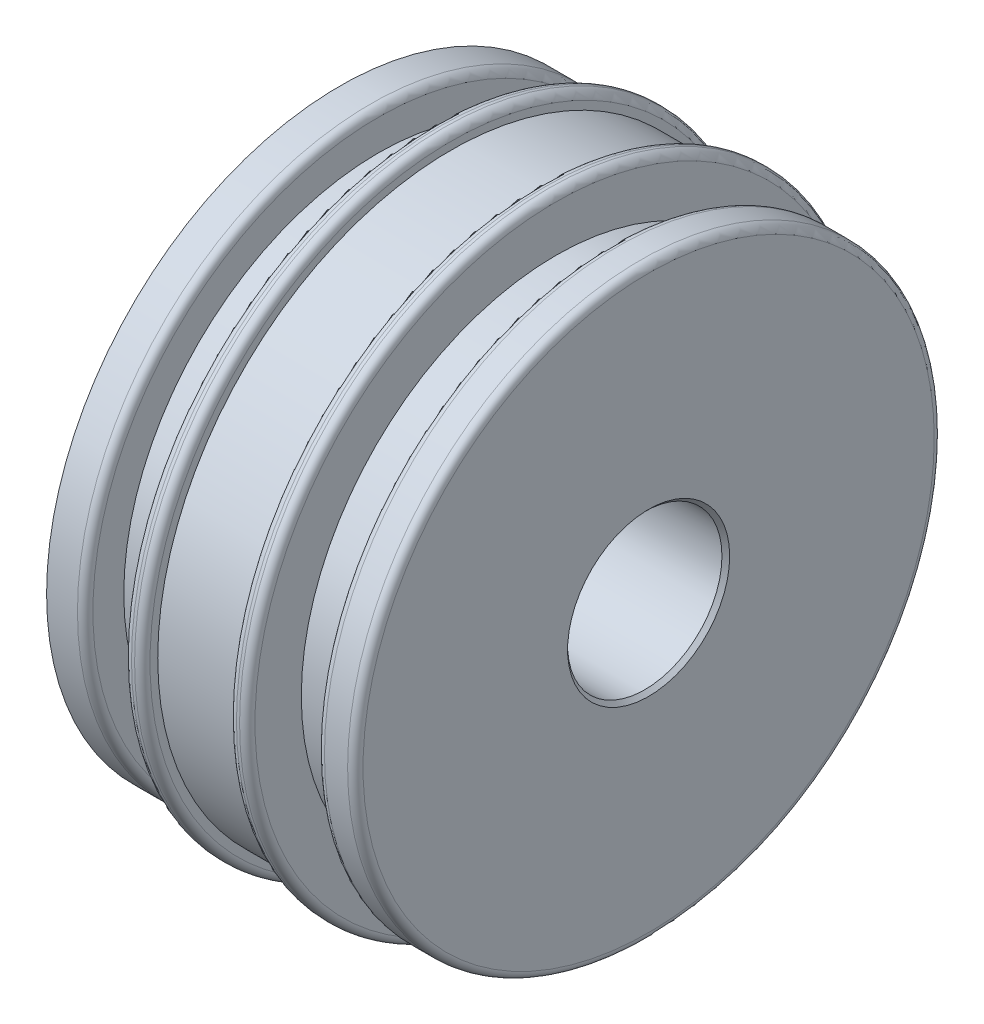
from build123d import *

# Parameters (mm, degrees)
CHAFL_N1_SIZE = 0.25
REDONDEO1_R   = 0.5


with BuildPart() as part:
    # Sketch1 → Revolución1 (revolve)
    with BuildSketch(Plane.XY, mode=Mode.PRIVATE) as revoluci_n1_sk:
        Polygon((-67.349324085, 19), (-69.849324085, 19), (-69.849324085, 16.5), (-73.349324085, 16.5), (-73.349324085, 20), (-74.549324085, 20), (-74.549324085, 19), (-80.149324085, 19), (-80.149324085, 20), (-81.349324085, 20), (-81.349324085, 16.5), (-84.849324085, 16.5), (-84.849324085, 19), (-87.349324085, 19), (-87.349324085, 7.957938343), (-86.052586618, 7.957938343), (-86.052586618, 6), (-84.208369925, 6), (-84.208369925, 8), (-81.408369925, 8), (-81.408369925, 5), (-67.349324085, 5), align=None)
    revolve(revoluci_n1_sk.sketch.rotate(Axis((0, 0, 0), (-1, 0, 0)), 90), axis=Axis((0, 0, 0), (-1, 0, 0)))

    # Chaflán1
    chafl_n1_edges = [part.edges().sort_by_distance(p)[0] for p in [
        (-67.349324085, 0, 5),
        (-81.408369925, 0, 5),
        (-81.408369925, 0, 8),
        (-84.208369925, 0, 8),
        (-84.208369925, 0, 6),
    ]]
    chamfer(chafl_n1_edges, length=CHAFL_N1_SIZE)

    # Redondeo1
    redondeo1_edges = [part.edges().sort_by_distance(p)[0] for p in [
        (-84.849324085, 0, 19),
        (-81.349324085, 0, 20),
        (-80.149324085, 0, 20),
        (-74.549324085, 0, 20),
        (-73.349324085, 0, 20),
        (-69.849324085, 0, 19),
        (-67.349324085, 0, 19),
    ]]
    fillet(redondeo1_edges, radius=REDONDEO1_R)


solid = part.part
